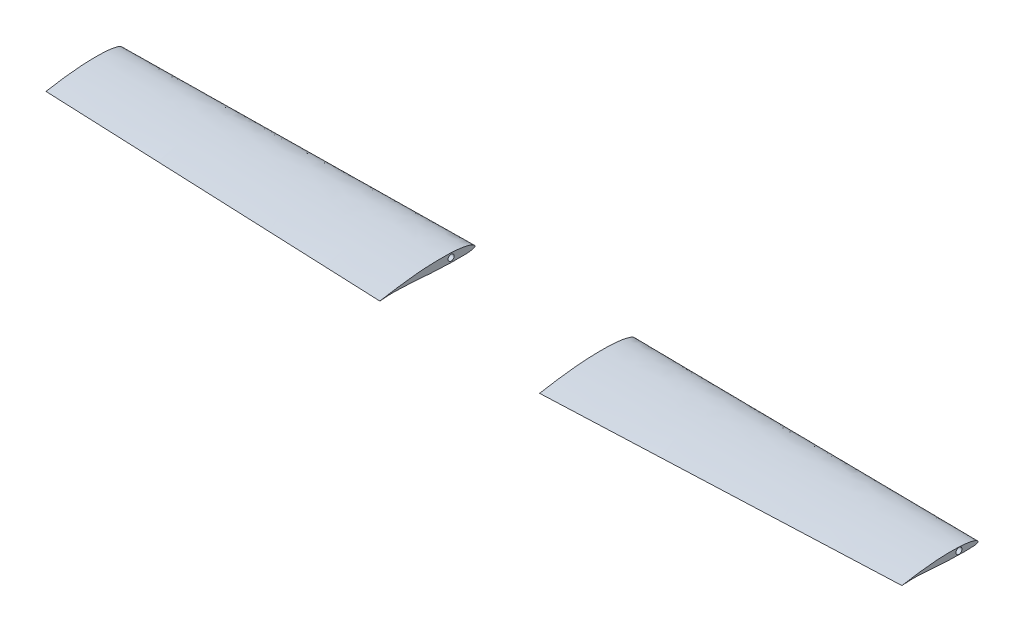
from build123d import *

# Parameters (mm, degrees)
SCHIZZO6_R                   = 8
FOROLONGHERONEDESTRO_DEPTH   = 926.44597991
FOROLONGHERONESINISTRO_START = 915
SCHIZZO9_R                   = 8
FOROLONGHERONESINISTRO_DEPTH = 915


with BuildPart() as part:
    # ProfiloDestro250 → Ala section 0
    with BuildSketch(Plane(origin=(210, 0, 0), x_dir=(0, 0, -1), z_dir=(1, 0, 0))):
        with BuildLine():
            add(Edge.make_bspline(
                [(-125, 43.17), (-125.000228294, 43.161957204), (-123.284955516, 43.342375658), (-121.518112419, 43.478690015), (-117.189387343, 43.855693594), (-111.806461263, 44.244101529), (-104.680385952, 44.66731724), (-96.184158698, 44.993218603), (-86.337618208, 45.137626101), (-75.371188527, 45.003221056), (-63.499913622, 44.55960529), (-50.953687417, 43.876014078), (-37.931424918, 43.009791358), (-24.615771744, 42.021983673), (-11.176354995, 40.97907509), (2.232859452, 39.950416021), (15.479946413, 39.017256873), (28.453904025, 38.231435635), (41.059180698, 37.633169297), (53.198160709, 37.222351795), (64.754743997, 36.951549061), (75.601267109, 36.814630244), (85.602773806, 36.788612037), (94.638065158, 36.90495077), (102.587818897, 37.157835083), (109.373772769, 37.572566099), (114.928092489, 38.241293421), (119.302307388, 39.129553019), (122.374679361, 40.304247016), (124.505115775, 41.45847153), (125.021312549, 42.759545769), (124.9688308, 43.962659827), (124.187400758, 45.475684337), (122.271136483, 47.408352424), (119.230092759, 49.288172121), (115.119057196, 51.083594202), (109.925069532, 52.811318178), (103.701247778, 54.453896488), (96.50282788, 55.958381759), (88.392626594, 57.267834908), (79.42697156, 58.329429017), (69.667089926, 59.130903998), (59.183463502, 59.664069738), (48.06862374, 59.961989705), (36.433050972, 60.034754131), (24.403000114, 59.896715291), (12.111174018, 59.553385064), (-0.311615819, 58.995573667), (-12.743791097, 58.22233187), (-25.072384382, 57.229339074), (-37.191375056, 56.051586986), (-48.989074322, 54.719280346), (-60.352364446, 53.286249729), (-71.163081698, 51.802379125), (-81.300441402, 50.301513884), (-90.560350587, 48.901221768), (-98.977157043, 47.463295127), (-106.363413336, 46.351808874), (-112.746440904, 45.268942417), (-117.622069366, 44.415861917), (-121.644529332, 43.722864946), (-123.32839844, 43.416216765), (-124.999773563, 43.177977377), (-125, 43.17)],
                knots=[0, 0, 0, 0, 0.001588889, 0.006329218, 0.014202456, 0.025172808, 0.039173483, 0.056060631, 0.075578924, 0.097363607, 0.120926258, 0.145825281, 0.171670912, 0.198108537, 0.224790184, 0.25139058, 0.277643491, 0.30332675, 0.328257458, 0.352272548, 0.375156062, 0.396620664, 0.416422729, 0.43430442, 0.45005468, 0.463465465, 0.474478994, 0.483169222, 0.489678354, 0.494104066, 0.496910015, 0.497289785, 0.501214273, 0.50645795, 0.513356957, 0.522168632, 0.53296597, 0.545689209, 0.560220779, 0.576438923, 0.594258689, 0.613600245, 0.634342386, 0.656331109, 0.679351894, 0.703152303, 0.727478208, 0.752070739, 0.776691164, 0.801140184, 0.825214387, 0.848697424, 0.871352858, 0.892947449, 0.913230871, 0.931955467, 0.948342069, 0.963693004, 0.976235918, 0.986320059, 0.993788799, 0.998424035, 1, 1, 1, 1], degree=3))
        make_face()
    # ProfiloDestro200 → Ala section 1
    with BuildSketch(Plane(origin=(1125, 0, 0), x_dir=(0, 0, -1), z_dir=(1, 0, 0))):
        with BuildLine():
            add(Edge.make_bspline(
                [(-87.5, 44.19), (-87.500182635, 44.183565763), (-86.127964412, 44.327900526), (-84.714489936, 44.436952012), (-81.251509875, 44.738554875), (-76.945169011, 45.049281223), (-71.244308761, 45.387853792), (-64.447326959, 45.648574882), (-56.570094566, 45.764100881), (-47.796950822, 45.656576845), (-38.299930898, 45.301684232), (-28.262949934, 44.754811262), (-17.845139934, 44.061833087), (-7.192617395, 43.271586938), (3.558916004, 42.437260072), (14.286287562, 41.614332817), (24.88395713, 40.867805499), (35.26312322, 40.239148508), (45.347344559, 39.760535438), (55.058528567, 39.431881436), (64.303795198, 39.215239249), (72.981013687, 39.105704195), (80.982219045, 39.08488963), (88.210452126, 39.177960616), (94.570255117, 39.380268066), (99.999018215, 39.712052879), (104.442473991, 40.247034737), (107.94184591, 40.957642415), (110.399743489, 41.897397612), (112.10409262, 42.820777224), (112.517050039, 43.861636615), (112.47506464, 44.824127861), (111.849920606, 46.03454747), (110.316909187, 47.58068194), (107.884074207, 49.084537697), (104.595245757, 50.520875361), (100.440055626, 51.903054543), (95.460998223, 53.21711719), (89.702262304, 54.420705407), (83.214101275, 55.468267927), (76.041577248, 56.317543214), (68.23367194, 56.958723198), (59.846770801, 57.385255791), (50.954898992, 57.623591764), (41.646440778, 57.681803305), (32.022400092, 57.571372233), (22.188939214, 57.296708051), (12.250707345, 56.850458933), (2.304967122, 56.231865496), (-7.557907506, 55.437471259), (-17.253100045, 54.495269589), (-26.691259458, 53.429424277), (-35.781891557, 52.282999783), (-44.430465358, 51.0959033), (-52.540353122, 49.895211107), (-59.94828047, 48.774977414), (-66.681725634, 47.624636102), (-72.590730669, 46.735447099), (-77.697152723, 45.869153934), (-81.597655493, 45.186689533), (-84.815623466, 44.632291957), (-86.162718752, 44.386973412), (-87.499818851, 44.196381902), (-87.5, 44.19)],
                knots=[0, 0, 0, 0, 0.001588889, 0.006329218, 0.014202456, 0.025172808, 0.039173483, 0.056060631, 0.075578924, 0.097363607, 0.120926258, 0.145825281, 0.171670912, 0.198108537, 0.224790184, 0.25139058, 0.277643491, 0.30332675, 0.328257458, 0.352272548, 0.375156062, 0.396620664, 0.416422729, 0.43430442, 0.45005468, 0.463465465, 0.474478994, 0.483169222, 0.489678354, 0.494104066, 0.496910015, 0.497289785, 0.501214273, 0.50645795, 0.513356957, 0.522168632, 0.53296597, 0.545689209, 0.560220779, 0.576438923, 0.594258689, 0.613600245, 0.634342386, 0.656331109, 0.679351894, 0.703152303, 0.727478208, 0.752070739, 0.776691164, 0.801140184, 0.825214387, 0.848697424, 0.871352858, 0.892947449, 0.913230871, 0.931955467, 0.948342069, 0.963693004, 0.976235918, 0.986320059, 0.993788799, 0.998424035, 1, 1, 1, 1], degree=3))
        make_face()
    loft()

    # Schizzo6 → ForoLongheroneDestro (cut, through all)
    with BuildSketch(Plane(origin=(1125, 0, 0), x_dir=(0, 0, -1), z_dir=(1, 0, 0))):
        with Locations((62.5, 48.251860305)):
            Circle(SCHIZZO6_R)
    extrude(amount=-FOROLONGHERONEDESTRO_DEPTH, mode=Mode.SUBTRACT)


with BuildPart() as body_2:
    # ProfiloSinistro200 → Loft1 section 0
    with BuildSketch(Plane(origin=(-1125, 0, 0), x_dir=(0, 0, -1), z_dir=(1, 0, 0))):
        with BuildLine():
            add(Edge.make_bspline(
                [(-87.5, 44.19), (-87.500182635, 44.183565763), (-86.127964412, 44.327900526), (-84.714489936, 44.436952012), (-81.251509875, 44.738554875), (-76.945169011, 45.049281223), (-71.244308761, 45.387853792), (-64.447326959, 45.648574882), (-56.570094566, 45.764100881), (-47.796950822, 45.656576845), (-38.299930898, 45.301684232), (-28.262949934, 44.754811262), (-17.845139934, 44.061833087), (-7.192617395, 43.271586938), (3.558916004, 42.437260072), (14.286287562, 41.614332817), (24.88395713, 40.867805499), (35.26312322, 40.239148508), (45.347344559, 39.760535438), (55.058528567, 39.431881436), (64.303795198, 39.215239249), (72.981013687, 39.105704195), (80.982219045, 39.08488963), (88.210452126, 39.177960616), (94.570255117, 39.380268066), (99.999018215, 39.712052879), (104.442473991, 40.247034737), (107.94184591, 40.957642415), (110.399743489, 41.897397612), (112.10409262, 42.820777224), (112.517050039, 43.861636615), (112.47506464, 44.824127861), (111.849920606, 46.03454747), (110.316909187, 47.58068194), (107.884074207, 49.084537697), (104.595245757, 50.520875361), (100.440055626, 51.903054543), (95.460998223, 53.21711719), (89.702262304, 54.420705407), (83.214101275, 55.468267927), (76.041577248, 56.317543214), (68.23367194, 56.958723198), (59.846770801, 57.385255791), (50.954898992, 57.623591764), (41.646440778, 57.681803305), (32.022400092, 57.571372233), (22.188939214, 57.296708051), (12.250707345, 56.850458933), (2.304967122, 56.231865496), (-7.557907506, 55.437471259), (-17.253100045, 54.495269589), (-26.691259458, 53.429424277), (-35.781891557, 52.282999783), (-44.430465358, 51.0959033), (-52.540353122, 49.895211107), (-59.94828047, 48.774977414), (-66.681725634, 47.624636102), (-72.590730669, 46.735447099), (-77.697152723, 45.869153934), (-81.597655493, 45.186689533), (-84.815623466, 44.632291957), (-86.162718752, 44.386973412), (-87.499818851, 44.196381902), (-87.5, 44.19)],
                knots=[0, 0, 0, 0, 0.001588889, 0.006329218, 0.014202456, 0.025172808, 0.039173483, 0.056060631, 0.075578924, 0.097363607, 0.120926258, 0.145825281, 0.171670912, 0.198108537, 0.224790184, 0.25139058, 0.277643491, 0.30332675, 0.328257458, 0.352272548, 0.375156062, 0.396620664, 0.416422729, 0.43430442, 0.45005468, 0.463465465, 0.474478994, 0.483169222, 0.489678354, 0.494104066, 0.496910015, 0.497289785, 0.501214273, 0.50645795, 0.513356957, 0.522168632, 0.53296597, 0.545689209, 0.560220779, 0.576438923, 0.594258689, 0.613600245, 0.634342386, 0.656331109, 0.679351894, 0.703152303, 0.727478208, 0.752070739, 0.776691164, 0.801140184, 0.825214387, 0.848697424, 0.871352858, 0.892947449, 0.913230871, 0.931955467, 0.948342069, 0.963693004, 0.976235918, 0.986320059, 0.993788799, 0.998424035, 1, 1, 1, 1], degree=3))
        make_face()
    # ProfiloSinistro250 → Loft1 section 1
    with BuildSketch(Plane(origin=(-210, 0, 0), x_dir=(0, 0, -1), z_dir=(1, 0, 0))):
        with BuildLine():
            add(Edge.make_bspline(
                [(-125, 43.17), (-125.000228294, 43.161957204), (-123.284955516, 43.342375658), (-121.518112419, 43.478690015), (-117.189387343, 43.855693594), (-111.806461263, 44.244101529), (-104.680385952, 44.66731724), (-96.184158698, 44.993218603), (-86.337618208, 45.137626101), (-75.371188527, 45.003221056), (-63.499913622, 44.55960529), (-50.953687417, 43.876014078), (-37.931424918, 43.009791358), (-24.615771744, 42.021983673), (-11.176354995, 40.97907509), (2.232859452, 39.950416021), (15.479946413, 39.017256873), (28.453904025, 38.231435635), (41.059180698, 37.633169297), (53.198160709, 37.222351795), (64.754743997, 36.951549061), (75.601267109, 36.814630244), (85.602773806, 36.788612037), (94.638065158, 36.90495077), (102.587818897, 37.157835083), (109.373772769, 37.572566099), (114.928092489, 38.241293421), (119.302307388, 39.129553019), (122.374679361, 40.304247016), (124.505115775, 41.45847153), (125.021312549, 42.759545769), (124.9688308, 43.962659827), (124.187400758, 45.475684337), (122.271136483, 47.408352424), (119.230092759, 49.288172121), (115.119057196, 51.083594202), (109.925069532, 52.811318178), (103.701247778, 54.453896488), (96.50282788, 55.958381759), (88.392626594, 57.267834908), (79.42697156, 58.329429017), (69.667089926, 59.130903998), (59.183463502, 59.664069738), (48.06862374, 59.961989705), (36.433050972, 60.034754131), (24.403000114, 59.896715291), (12.111174018, 59.553385064), (-0.311615819, 58.995573667), (-12.743791097, 58.22233187), (-25.072384382, 57.229339074), (-37.191375056, 56.051586986), (-48.989074322, 54.719280346), (-60.352364446, 53.286249729), (-71.163081698, 51.802379125), (-81.300441402, 50.301513884), (-90.560350587, 48.901221768), (-98.977157043, 47.463295127), (-106.363413336, 46.351808874), (-112.746440904, 45.268942417), (-117.622069366, 44.415861917), (-121.644529332, 43.722864946), (-123.32839844, 43.416216765), (-124.999773563, 43.177977377), (-125, 43.17)],
                knots=[0, 0, 0, 0, 0.001588889, 0.006329218, 0.014202456, 0.025172808, 0.039173483, 0.056060631, 0.075578924, 0.097363607, 0.120926258, 0.145825281, 0.171670912, 0.198108537, 0.224790184, 0.25139058, 0.277643491, 0.30332675, 0.328257458, 0.352272548, 0.375156062, 0.396620664, 0.416422729, 0.43430442, 0.45005468, 0.463465465, 0.474478994, 0.483169222, 0.489678354, 0.494104066, 0.496910015, 0.497289785, 0.501214273, 0.50645795, 0.513356957, 0.522168632, 0.53296597, 0.545689209, 0.560220779, 0.576438923, 0.594258689, 0.613600245, 0.634342386, 0.656331109, 0.679351894, 0.703152303, 0.727478208, 0.752070739, 0.776691164, 0.801140184, 0.825214387, 0.848697424, 0.871352858, 0.892947449, 0.913230871, 0.931955467, 0.948342069, 0.963693004, 0.976235918, 0.986320059, 0.993788799, 0.998424035, 1, 1, 1, 1], degree=3))
        make_face()
    loft()

    # Schizzo9 → ForoLongheroneSinistro (cut)
    with BuildSketch(Plane(origin=(-1125, 0, 0), x_dir=(0, 0, -1), z_dir=(1, 0, 0)).offset(FOROLONGHERONESINISTRO_START)):
        with Locations(Location((62.5, 48.251860305, 0), (0, 0, 180))):
            Circle(SCHIZZO9_R)
    extrude(amount=-FOROLONGHERONESINISTRO_DEPTH, mode=Mode.SUBTRACT)


solid = Compound([part.part, body_2.part])
